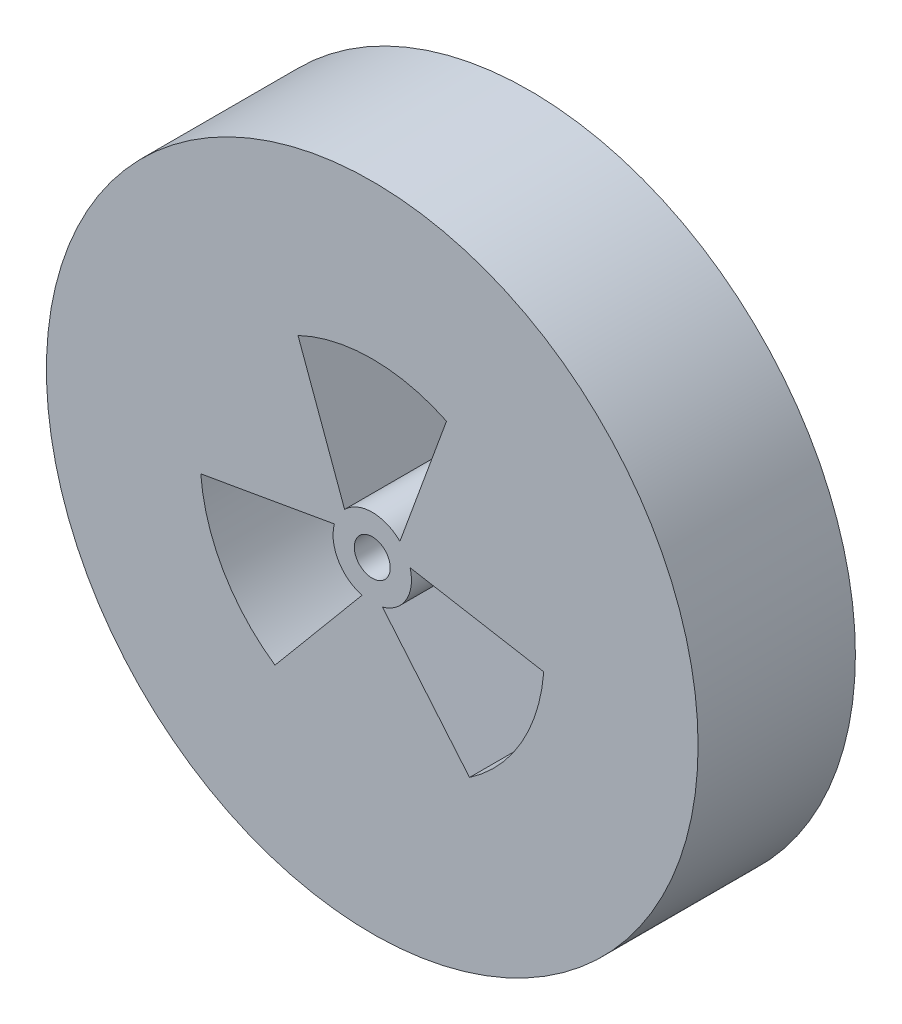
from build123d import *

# Parameters (mm, degrees)
SKETCH1_R            = 72.5
SKETCH1_R_2          = 4
BOSS_EXTRUDE1_DEPTH  = 35
CUT_EXTRUDE1_DEPTH   = 35
CIRPATTERN6_COUNT    = 3
MIRROR2_COPY_1_DEPTH = 35
MIRROR2_COPY_2_DEPTH = 35


with BuildPart() as part:
    # Sketch1 → Boss-Extrude1 (new body)
    with BuildSketch(Plane.XY):
        Circle(SKETCH1_R)
        Circle(SKETCH1_R_2, mode=Mode.SUBTRACT)
    extrude(amount=BOSS_EXTRUDE1_DEPTH)

    # Sketch3 → Cut-Extrude1 (cut)
    with BuildSketch(Plane.XY.offset(35)):
        with BuildLine():
            Line((0, 38.272172541), (0, 8.722907964))
            ThreePointArc((0, 8.722907964), (-3.329803479, 8.062352767), (-6.155298303, 6.180730228))
            Line((-6.155298303, 6.180730228), (-16.518963046, 34.523659292))
            ThreePointArc((-16.518963046, 34.523659292), (-8.469467098, 37.323281181), (0, 38.272172541))
        make_face()
    cut_extrude1 = extrude(amount=-CUT_EXTRUDE1_DEPTH, mode=Mode.SUBTRACT)

    # Mirror1: Cut-Extrude1 across plane
    add(cut_extrude1.mirror(Plane(origin=(0, 38.272172541, 0), x_dir=(0, 0, 1), z_dir=(1, 0, 0))), mode=Mode.SUBTRACT)

    # CirPattern6: Cut-Extrude1 ×3 about axis
    cirpattern6_axis = Axis((0, 0, 0), (0, 0, 1))
    for i in range(1, CIRPATTERN6_COUNT):
        add(cut_extrude1.rotate(cirpattern6_axis, i * 360 / CIRPATTERN6_COUNT), mode=Mode.SUBTRACT)

    # Mirror2: Cut-Extrude1 across plane
    add(cut_extrude1.mirror(Plane(origin=(33.144673679, -19.136086271, 0), x_dir=(0, 0, 1), z_dir=(-0.5000000000000041, -0.8660254037844364, 0))), mode=Mode.SUBTRACT)

    # Mirror2 copy 1 sketch → Mirror2 copy 1 (cut)
    with BuildSketch(Plane(origin=(0, 0, 35), x_dir=(-1, 0, 0), z_dir=(0, 0, 1))):
        with BuildLine():
            Line((0, -38.272172541), (0, -8.722907964))
            ThreePointArc((0, -8.722907964), (-3.329803479, -8.062352767), (-6.155298303, -6.180730228))
            Line((-6.155298303, -6.180730228), (-16.518963046, -34.523659292))
            ThreePointArc((-16.518963046, -34.523659292), (-8.469467098, -37.323281181), (0, -38.272172541))
        make_face()
    extrude(amount=-MIRROR2_COPY_1_DEPTH, mode=Mode.SUBTRACT)

    # Mirror2 copy 2 sketch → Mirror2 copy 2 (cut)
    with BuildSketch(Plane(origin=(0, 0, 35), x_dir=(0.5000000000000079, 0.8660254037844346, 0), z_dir=(0, 0, 1))):
        with BuildLine():
            Line((0, -38.272172541), (0, -8.722907964))
            ThreePointArc((0, -8.722907964), (-3.329803479, -8.062352767), (-6.155298303, -6.180730228))
            Line((-6.155298303, -6.180730228), (-16.518963046, -34.523659292))
            ThreePointArc((-16.518963046, -34.523659292), (-8.469467098, -37.323281181), (0, -38.272172541))
        make_face()
    extrude(amount=-MIRROR2_COPY_2_DEPTH, mode=Mode.SUBTRACT)


solid = part.part
